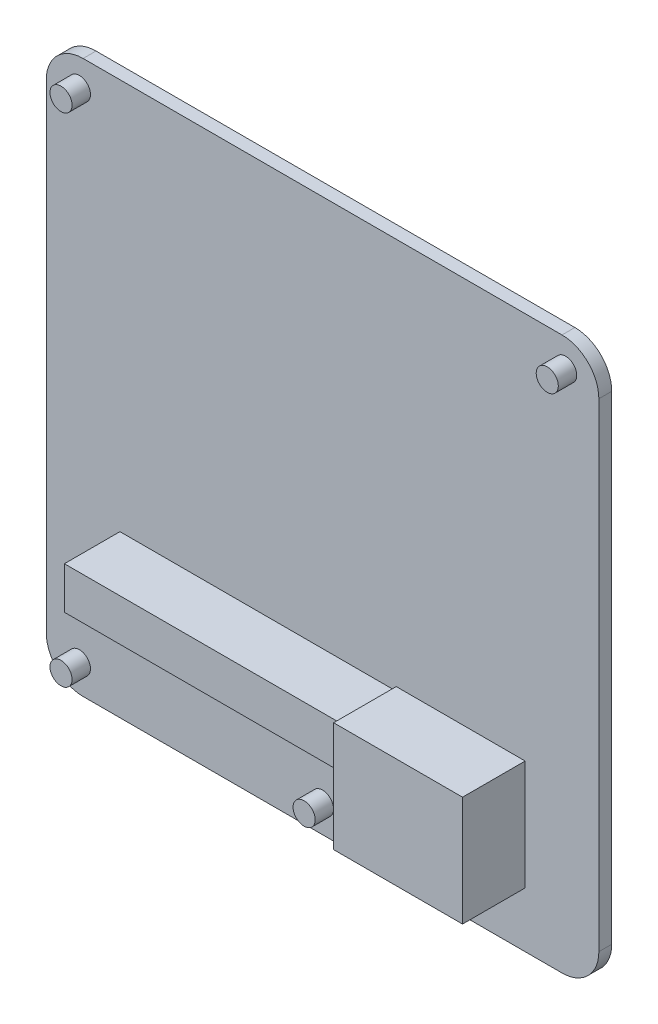
from build123d import *

# Parameters (mm, degrees)
BOSS_EXTRUDE1_DEPTH  = 3.5
SKETCH3_W            = 35
SKETCH3_H            = 40
BOSS_EXTRUDE2_DEPTH  = 17
SKETCH5_W            = 32.32
SKETCH5_H            = 12.1
CUT_EXTRUDE1_DEPTH   = 10.75
SKETCH6_W            = 28.5
SKETCH6_H            = 12.5
CUT_EXTRUDE2_DEPTH   = 17
SKETCH10_R           = 3
BOSS_EXTRUDE7_DEPTH  = 5
SKETCH11_R           = 3
BOSS_EXTRUDE8_DEPTH  = 5
SKETCH12_W           = 9
SKETCH12_H           = 6.5
CUT_EXTRUDE3_DEPTH   = 20
SKETCH13_W           = 17
SKETCH13_H           = 6.985272442
CUT_EXTRUDE4_DEPTH   = 140.119509628
SKETCH14_W           = 17
SKETCH14_H           = 3.182225524
CUT_EXTRUDE5_DEPTH   = 140.119509628
SKETCH15_W           = 13.15864123
SKETCH15_H           = 11.411738648
SKETCH15_W_2         = 10.578454188
SKETCH15_H_2         = 8.248928726
BOSS_EXTRUDE9_DEPTH  = 75
SKETCH16_W           = 1.920679385
SKETCH16_H           = 11.453083587
BOSS_EXTRUDE10_DEPTH = 75


with BuildPart() as part:
    # Sketch2 → Boss-Extrude1 (new body)
    with BuildSketch(Plane.XY):
        with BuildLine():
            Line((65, -99.543899658), (-65, -99.543899658))
            ThreePointArc((-65, -99.543899658), (-72.071067812, -96.61496747), (-75, -89.543899658))
            Line((-75, -89.543899658), (-75, 40.456100342))
            ThreePointArc((-75, 40.456100342), (-72.071067812, 47.527168154), (-65, 50.456100342))
            Line((-65, 50.456100342), (65, 50.456100342))
            ThreePointArc((65, 50.456100342), (72.071067812, 47.527168154), (75, 40.456100342))
            Line((75, 40.456100342), (75, -89.543899658))
            ThreePointArc((75, -89.543899658), (72.071067812, -96.61496747), (65, -99.543899658))
        make_face()
    extrude(amount=BOSS_EXTRUDE1_DEPTH)

    # Sketch3 → Boss-Extrude2 (add)
    with BuildSketch(Plane.XY.offset(3.5)):
        with Locations((37.5, -64.543899658)):
            Rectangle(SKETCH3_W, SKETCH3_H)
    extrude(amount=BOSS_EXTRUDE2_DEPTH)

    # Sketch5 → Cut-Extrude1 (cut)
    with BuildSketch(Plane.XZ.offset(84.543899658)):
        with Locations((37.5, 12)):
            Rectangle(SKETCH5_W, SKETCH5_H)
    extrude(amount=-CUT_EXTRUDE1_DEPTH, mode=Mode.SUBTRACT)

    # Sketch6 → Cut-Extrude2 (cut)
    with BuildSketch(Plane.XZ.offset(73.793899658)):
        with Locations((37.5, 12)):
            Rectangle(SKETCH6_W, SKETCH6_H)
    extrude(amount=-CUT_EXTRUDE2_DEPTH, mode=Mode.SUBTRACT)

    # Sketch10 → Boss-Extrude7 (add)
    with BuildSketch(Plane.XY.offset(3.5)):
        with Locations((0, -92.043899658)):
            Circle(SKETCH10_R)
        with Locations((-66, -92.043899658)):
            Circle(SKETCH10_R)
    extrude(amount=BOSS_EXTRUDE7_DEPTH)

    # Sketch11 → Boss-Extrude8 (add)
    with BuildSketch(Plane.XY.offset(3.5)):
        with Locations((-66, 42.956100342)):
            Circle(SKETCH11_R)
        with Locations((66, 42.956100342)):
            Circle(SKETCH11_R)
    extrude(amount=BOSS_EXTRUDE8_DEPTH)

    # Sketch12 → Cut-Extrude3 (cut)
    with BuildSketch(Plane.ZY.offset(-20)):
        with Locations((12, -61.493899658)):
            Rectangle(SKETCH12_W, SKETCH12_H)
    extrude(amount=-CUT_EXTRUDE3_DEPTH, mode=Mode.SUBTRACT)

    # Sketch13 → Cut-Extrude4 (cut, through all)
    with BuildSketch(Plane.ZY.offset(-20)):
        with Locations((12, -48.036535879)):
            Rectangle(SKETCH13_W, SKETCH13_H)
    extrude(amount=-CUT_EXTRUDE4_DEPTH, mode=Mode.SUBTRACT)

    # Sketch14 → Cut-Extrude5 (cut, through all)
    with BuildSketch(Plane.ZY.offset(-20)):
        with Locations((12, -53.120284862)):
            Rectangle(SKETCH14_W, SKETCH14_H)
    extrude(amount=-CUT_EXTRUDE5_DEPTH, mode=Mode.SUBTRACT)

    # Sketch15 → Boss-Extrude9 (add)
    with BuildSketch(Plane.ZY.offset(-20)):
        with Locations((12, -61.493899658)):
            Rectangle(SKETCH15_W, SKETCH15_H)
        with Locations((12, -61.493899658)):
            Rectangle(SKETCH15_W_2, SKETCH15_H_2, mode=Mode.SUBTRACT)
    extrude(amount=BOSS_EXTRUDE9_DEPTH)

    # Sketch16 → Boss-Extrude10 (add)
    with BuildSketch(Plane.ZY.offset(-20)):
        with Locations((4.460339692, -61.514572128)):
            Rectangle(SKETCH16_W, SKETCH16_H)
    extrude(amount=BOSS_EXTRUDE10_DEPTH)


solid = part.part
